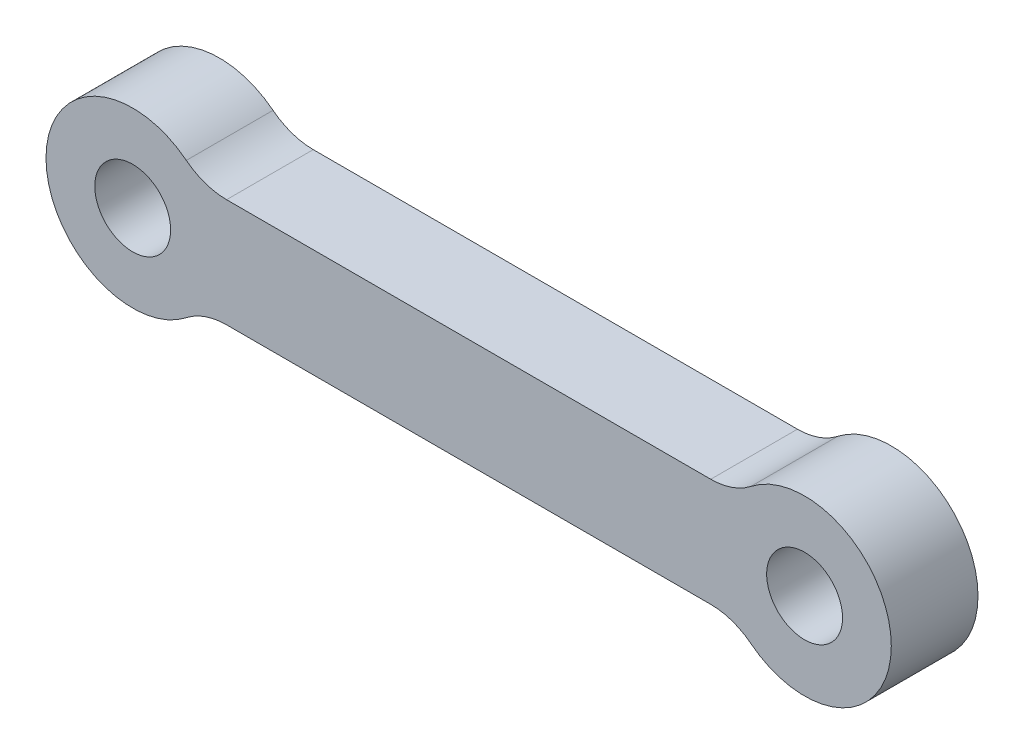
from build123d import *

# Parameters (mm, degrees)
SKETCH1_R           = 1.75
BOSS_EXTRUDE1_DEPTH = 2
FILLET1_R           = 3


with BuildPart() as part:
    # Sketch1 → Boss-Extrude1 (new, symmetric)
    with BuildSketch(Plane.XY):
        with BuildLine():
            ThreePointArc((-12.377501001, 2.5), (-19.5, 0), (-12.377501001, -2.5))
            Line((-12.377501001, -2.5), (12.377501001, -2.5))
            ThreePointArc((12.377501001, -2.5), (19.5, 0), (12.377501001, 2.5))
            Line((12.377501001, 2.5), (-12.377501001, 2.5))
        make_face()
        with Locations((-15.5, 0)):
            Circle(SKETCH1_R, mode=Mode.SUBTRACT)
        with Locations((15.5, 0)):
            Circle(SKETCH1_R, mode=Mode.SUBTRACT)
    extrude(amount=BOSS_EXTRUDE1_DEPTH, both=True)

    # Fillet1
    fillet1_edges = [part.edges().sort_by_distance(p)[0] for p in [
        (-12.377501001, -2.5, 0),
        (-12.377501001, 2.5, 0),
        (12.377501001, 2.5, 0),
        (12.377501001, -2.5, 0),
    ]]
    fillet(fillet1_edges, radius=FILLET1_R)


solid = part.part
